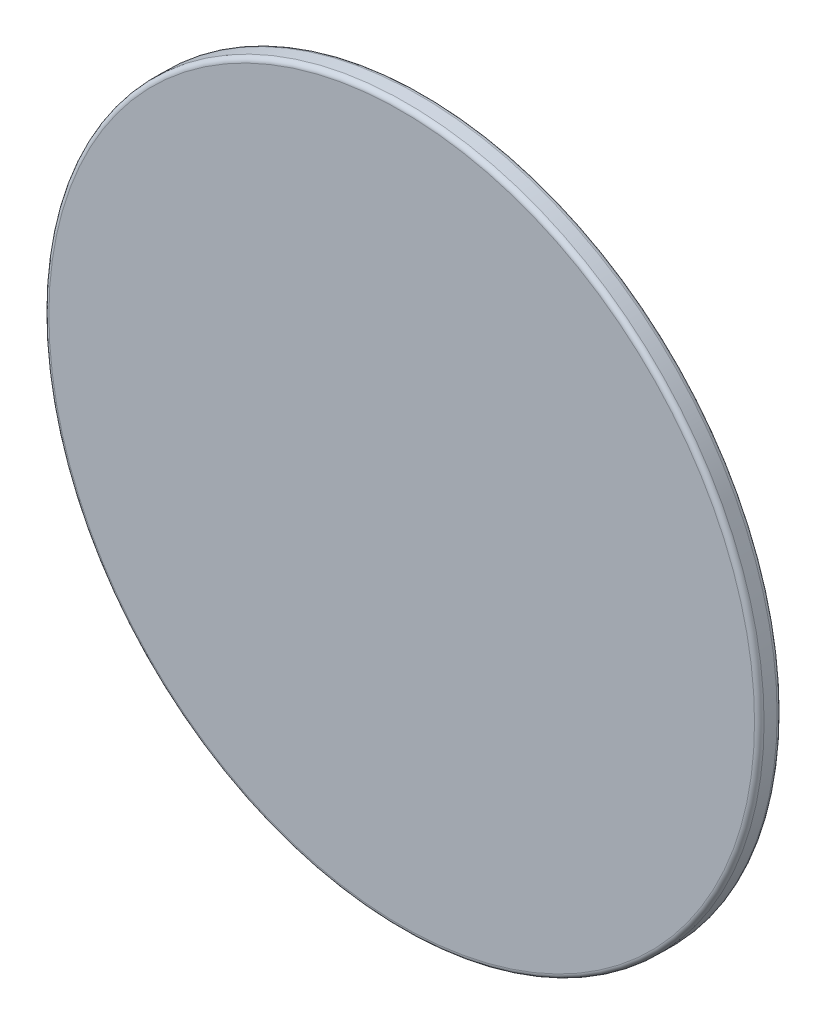
from build123d import *

# Parameters (mm, degrees)
SKETCH1_R           = 19
BOSS_EXTRUDE1_DEPTH = 1.2
FILLET1_R           = 0.254


with BuildPart() as part:
    # Sketch1 → Boss-Extrude1 (new body)
    with BuildSketch(Plane.XY):
        Circle(SKETCH1_R)
    extrude(amount=BOSS_EXTRUDE1_DEPTH)

    # Fillet1
    fillet1_edges = [part.edges().sort_by_distance(p)[0] for p in [
        (-19, 0, 0),
        (-19, 0, 1.2),
    ]]
    fillet(fillet1_edges, radius=FILLET1_R)


solid = part.part
